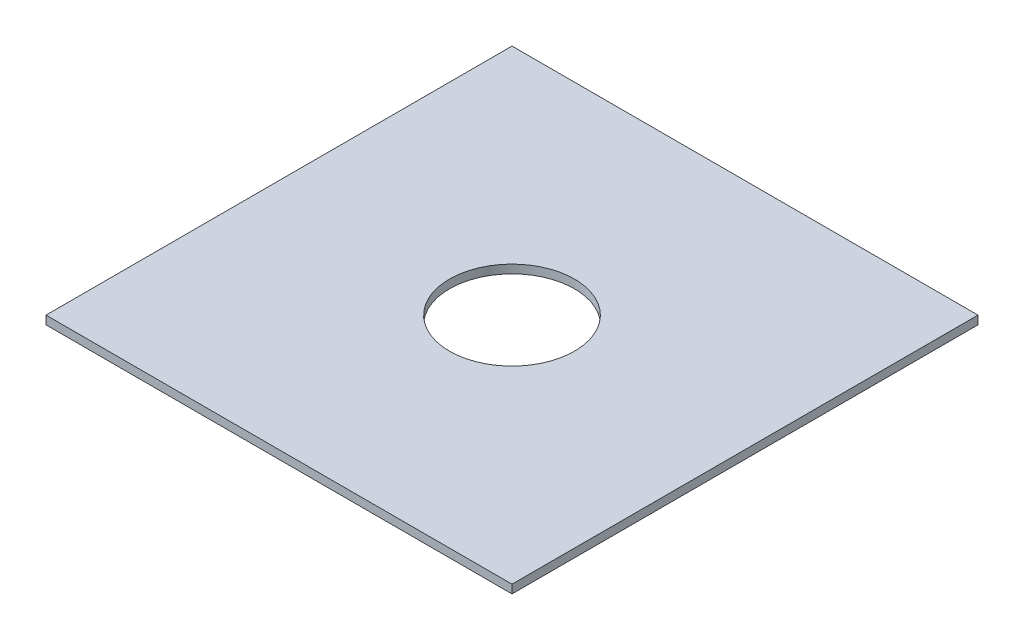
from build123d import *

# Parameters (mm, degrees)
SKETCH1_W           = 110
SKETCH1_H           = 110
BOSS_EXTRUDE1_DEPTH = 2
SKETCH2_R           = 14.755262175
CUT_EXTRUDE1_DEPTH  = 78.807454656


with BuildPart() as part:
    # Sketch1 → Boss-Extrude1 (new body)
    with BuildSketch(Plane(origin=(0, 0, 0), x_dir=(1, 0, 0), z_dir=(0, 1, 0))):
        Rectangle(SKETCH1_W, SKETCH1_H)
    extrude(amount=BOSS_EXTRUDE1_DEPTH)

    # Sketch2 → Cut-Extrude1 (cut, through all)
    with BuildSketch(Plane(origin=(0, 2, 0), x_dir=(1, 0, 0), z_dir=(0, 1, 0))):
        with Locations(Location((0, 0, 0), (0, 0, 270))):
            Circle(SKETCH2_R)
    extrude(amount=-CUT_EXTRUDE1_DEPTH, mode=Mode.SUBTRACT)


solid = part.part
